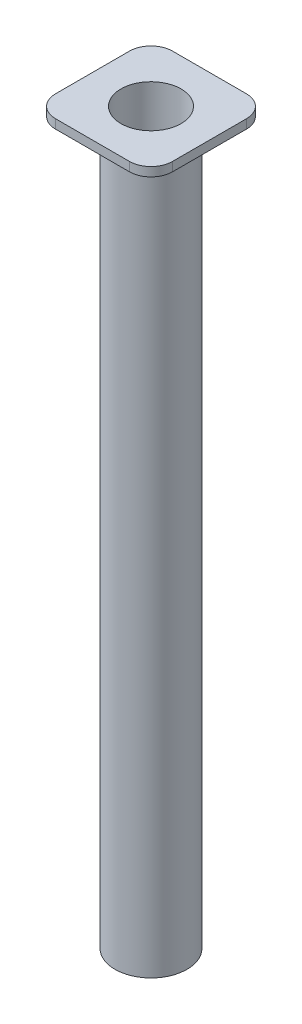
from build123d import *

# Parameters (mm, degrees)
SKETCH1_W           = 20
SKETCH1_H           = 405
BOSS_EXTRUDE1_DEPTH = 5
CUT_EXTRUDE1_REACH  = 409.6
SKETCH3_R           = 16.7


with BuildPart() as part:
    # Sketch1 → Revolve1 (revolve)
    with BuildSketch(Plane.XY, mode=Mode.PRIVATE) as revolve1_sk:
        with Locations((10, 202.5)):
            Rectangle(SKETCH1_W, SKETCH1_H)
    revolve(revolve1_sk.sketch.rotate(Axis((0, 405, 0), (0, -1, 0)), 180), axis=Axis((0, 405, 0), (0, -1, 0)))

    # Sketch2 → Boss-Extrude1 (add)
    with BuildSketch(Plane(origin=(0, 405, 0), x_dir=(1, 0, 0), z_dir=(0, 1, 0))):
        with BuildLine():
            Line((-20.5, -32.5), (20.5, -32.5))
            ThreePointArc((20.5, -32.5), (28.985281374, -28.985281374), (32.5, -20.5))
            Line((32.5, -20.5), (32.5, 20.5))
            ThreePointArc((32.5, 20.5), (28.985281374, 28.985281374), (20.5, 32.5))
            Line((20.5, 32.5), (-20.5, 32.5))
            ThreePointArc((-20.5, 32.5), (-28.985281374, 28.985281374), (-32.5, 20.5))
            Line((-32.5, 20.5), (-32.5, -20.5))
            ThreePointArc((-32.5, -20.5), (-28.985281374, -28.985281374), (-20.5, -32.5))
        make_face()
    extrude(amount=-BOSS_EXTRUDE1_DEPTH)

    # Sketch3 → Cut-Extrude1 (cut, up to next)
    with BuildSketch(Plane.XZ, mode=Mode.PRIVATE) as cut_extrude1_sk1:
        Circle(SKETCH3_R)
    cut_extrude1_tool1 = extrude(cut_extrude1_sk1.sketch, amount=-CUT_EXTRUDE1_REACH, mode=Mode.PRIVATE) & part.part
    add(cut_extrude1_tool1.solids().sort_by_distance((0, 0, 0))[0], mode=Mode.SUBTRACT)


solid = part.part
